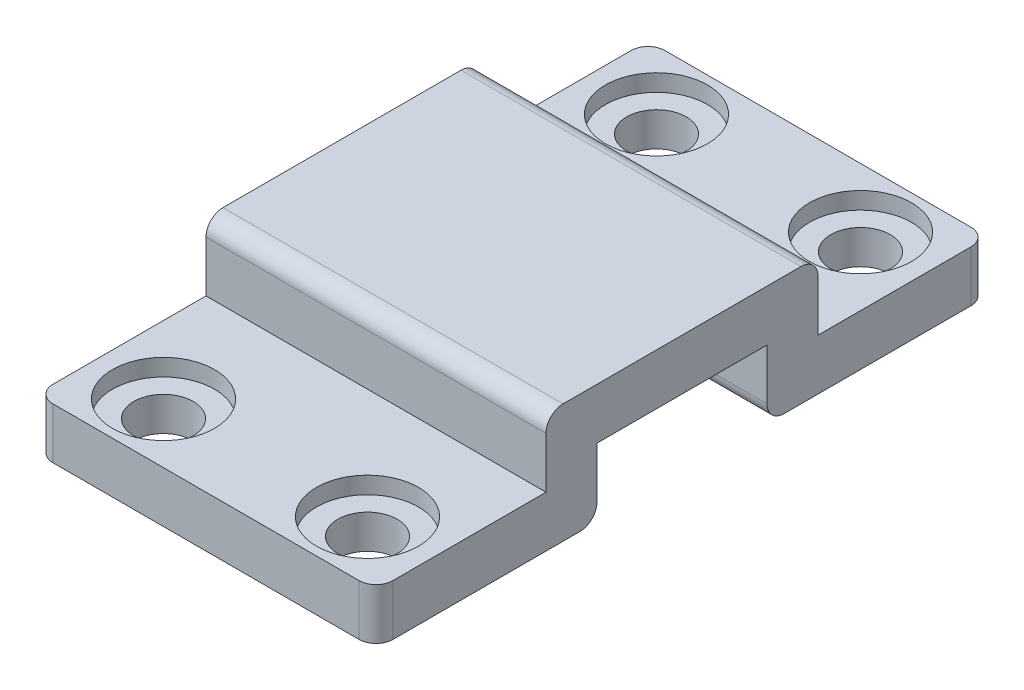
from build123d import *

# Parameters (mm, degrees)
SKETCH_21_W         = 20
SKETCH_21_H         = 10
EXTRUDE_3_DEPTH     = 3
SKETCH_22_W         = 20
SKETCH_22_H         = 3
EXTRUDE_4_DEPTH     = 7
SKETCH_23_W         = 20
SKETCH_23_H         = 3
EXTRUDE_5_DEPTH     = 10
SKETCH_24_W         = 20
SKETCH_24_H         = 3
EXTRUDE_6_DEPTH     = 10
SKETCH_25_R         = 1.75
CUT_EXTRUDE_1_DEPTH = 21.976176963
SKETCH_26_R         = 3
SKETCH_26_R_2       = 1.75
CUT_EXTRUDE_2_DEPTH = 1
FILLET_1_R          = 1


with BuildPart() as part:
    # 草图21 → 凸台-拉伸3 (new body)
    with BuildSketch(Plane(origin=(0, 0, 0), x_dir=(1, 0, 0), z_dir=(0, 1, 0))):
        Rectangle(SKETCH_21_W, SKETCH_21_H)
    extrude(amount=EXTRUDE_3_DEPTH)

    # 草图22 → 凸台-拉伸4 (add)
    with BuildSketch(Plane(origin=(0, 3, 0), x_dir=(1, 0, 0), z_dir=(0, 1, 0))):
        with Locations((0, -6.5)):
            Rectangle(SKETCH_22_W, SKETCH_22_H)
        with Locations((0, 6.5)):
            Rectangle(SKETCH_22_W, SKETCH_22_H)
    extrude(amount=-EXTRUDE_4_DEPTH)

    # 草图23 → 凸台-拉伸5 (add)
    with BuildSketch(Plane.XY.offset(8)):
        with Locations((0, -2.5)):
            Rectangle(SKETCH_23_W, SKETCH_23_H)
    extrude(amount=EXTRUDE_5_DEPTH)

    # 草图24 → 凸台-拉伸6 (add)
    with BuildSketch(Plane(origin=(0, 0, -8), x_dir=(-1, 0, 0), z_dir=(0, 0, -1))):
        with Locations((0, -2.5)):
            Rectangle(SKETCH_24_W, SKETCH_24_H)
    extrude(amount=EXTRUDE_6_DEPTH)

    # 草图25 → 切除-拉伸1 (cut, through all)
    with BuildSketch(Plane(origin=(0, -1, 0), x_dir=(1, 0, 0), z_dir=(0, 1, 0))):
        with Locations(Location((-6, 14.5, 0), (0, 0, 270))):
            Circle(SKETCH_25_R)
        with Locations(Location((6, 14.5, 0), (0, 0, 270))):
            Circle(SKETCH_25_R)
        with Locations(Location((-6, -14.5, 0), (0, 0, 270))):
            Circle(SKETCH_25_R)
        with Locations(Location((6, -14.5, 0), (0, 0, 270))):
            Circle(SKETCH_25_R)
    extrude(amount=-CUT_EXTRUDE_1_DEPTH, mode=Mode.SUBTRACT)

    # 草图26 → 切除-拉伸2 (cut)
    # profile 1 of 4: a face of its own
    with BuildSketch(Plane(origin=(0, -1, 0), x_dir=(1, 0, 0), z_dir=(0, 1, 0))):
        with Locations(Location((-6, 14.5, 0), (0, 0, 270))):
            Circle(SKETCH_26_R)
        with Locations(Location((-6, 14.5, 0), (0, 0, 270))):
            Circle(SKETCH_26_R_2, mode=Mode.SUBTRACT)
    # profile 2 of 4: a face of its own
    with BuildSketch(Plane(origin=(0, -1, 0), x_dir=(1, 0, 0), z_dir=(0, 1, 0))):
        with Locations(Location((6, 14.5, 0), (0, 0, 270))):
            Circle(SKETCH_26_R)
        with Locations(Location((6, 14.5, 0), (0, 0, 270))):
            Circle(SKETCH_26_R_2, mode=Mode.SUBTRACT)
    # profile 3 of 4: a face of its own
    with BuildSketch(Plane(origin=(0, -1, 0), x_dir=(1, 0, 0), z_dir=(0, 1, 0))):
        with Locations(Location((-6, -14.5, 0), (0, 0, 270))):
            Circle(SKETCH_26_R)
        with Locations(Location((-6, -14.5, 0), (0, 0, 270))):
            Circle(SKETCH_26_R_2, mode=Mode.SUBTRACT)
    # profile 4 of 4: a face of its own
    with BuildSketch(Plane(origin=(0, -1, 0), x_dir=(1, 0, 0), z_dir=(0, 1, 0))):
        with Locations(Location((6, -14.5, 0), (0, 0, 270))):
            Circle(SKETCH_26_R)
        with Locations(Location((6, -14.5, 0), (0, 0, 270))):
            Circle(SKETCH_26_R_2, mode=Mode.SUBTRACT)
    extrude(amount=-CUT_EXTRUDE_2_DEPTH, mode=Mode.SUBTRACT)

    # 圆角1
    fillet_1_edges = [part.edges().sort_by_distance(p)[0] for p in [
        (10, -2.5, 18),
        (-10, -2.5, 18),
        (-10, -2.5, -18),
        (10, -2.5, -18),
        (0, 3, 8),
        (0, 3, -8),
        (0, -4, 5),
        (0, -4, -5),
    ]]
    fillet(fillet_1_edges, radius=FILLET_1_R)


solid = part.part
